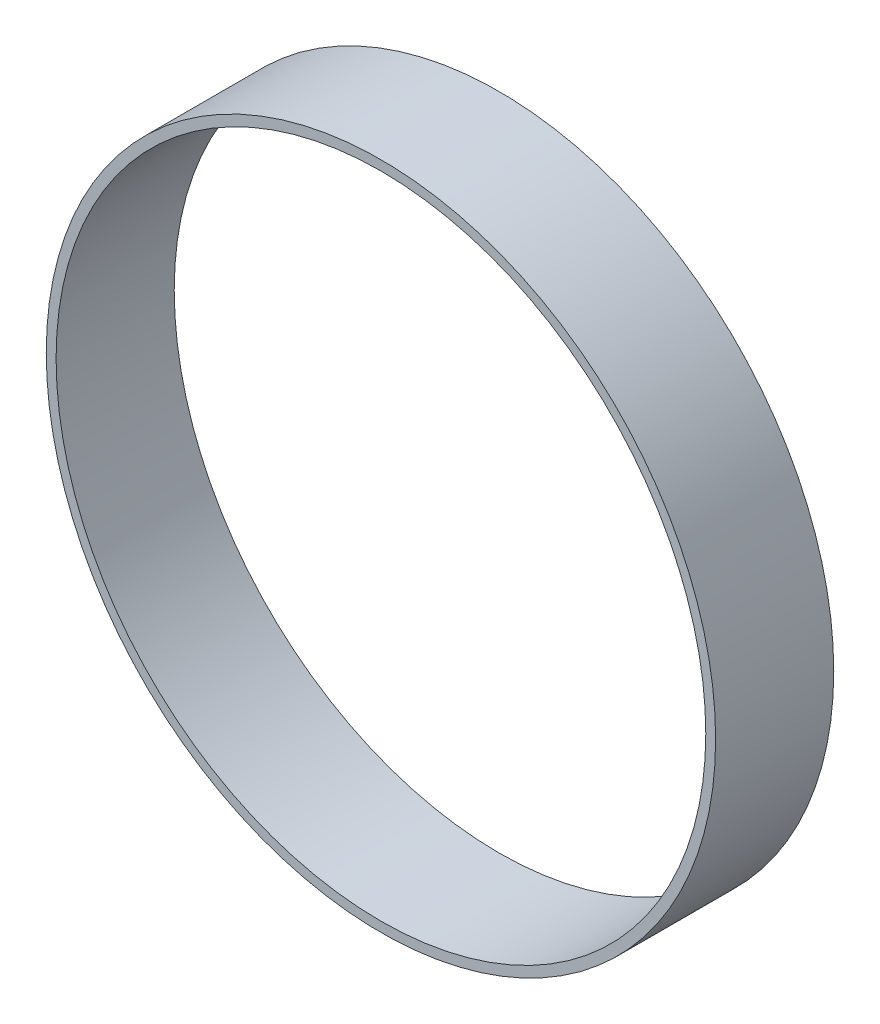
from build123d import *

# Parameters (mm, degrees)
SKETCH1_R           = 107.95
SKETCH1_R_2         = 104.775
BOSS_EXTRUDE1_DEPTH = 38.1


with BuildPart() as part:
    # Sketch1 → Boss-Extrude1 (new body)
    with BuildSketch(Plane(origin=(0, 0, 0), x_dir=(0, 1, 0), z_dir=(0, 0, 1))):
        with Locations(Location((0, 0, 0), (0, 0, 90))):
            Circle(SKETCH1_R)
        with Locations(Location((0, 0, 0), (0, 0, 90))):
            Circle(SKETCH1_R_2, mode=Mode.SUBTRACT)
    extrude(amount=BOSS_EXTRUDE1_DEPTH)


solid = part.part
